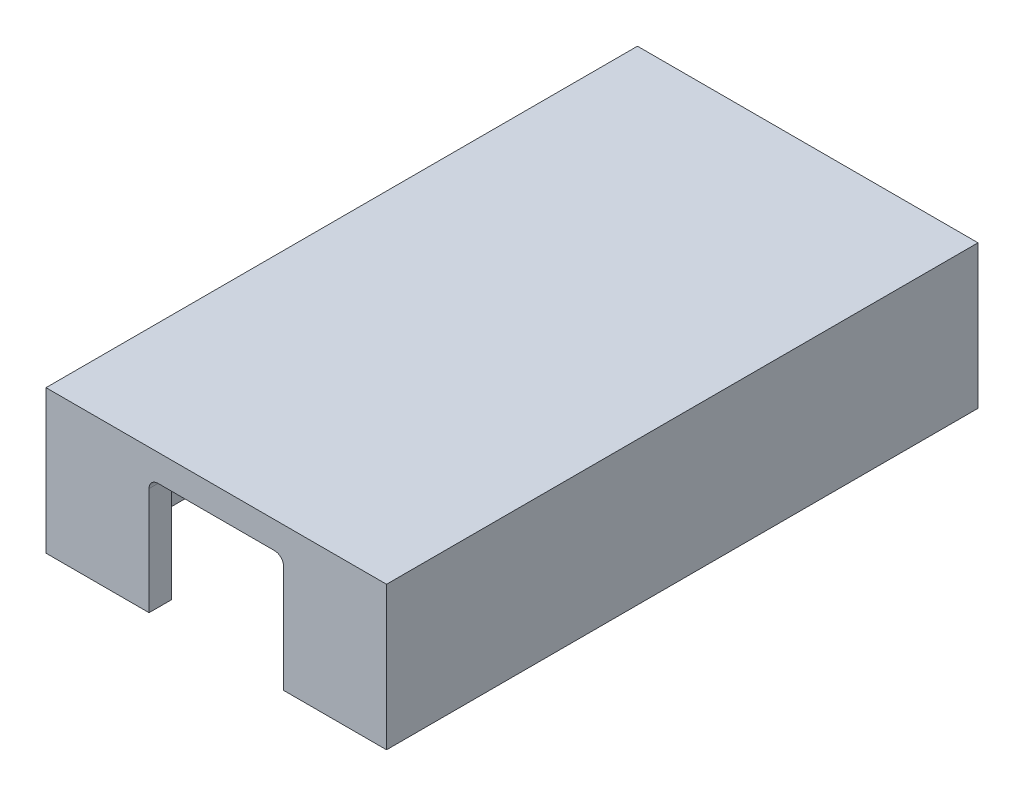
from build123d import *

# Parameters (mm, degrees)
SKETCH1_W           = 38
SKETCH1_H           = 66
BOSS_EXTRUDE1_DEPTH = 3
BOSS_EXTRUDE3_DEPTH = 13
SKETCH5_W           = 15
SKETCH5_H           = 1.5
BOSS_EXTRUDE4_DEPTH = 1.5
FILLET2_R           = 1
FILLET3_R           = 1


with BuildPart() as part:
    # Sketch1 → Boss-Extrude1 (new body)
    with BuildSketch(Plane(origin=(0, 0, 0), x_dir=(1, 0, 0), z_dir=(0, 1, 0))):
        Rectangle(SKETCH1_W, SKETCH1_H)
    extrude(amount=BOSS_EXTRUDE1_DEPTH)

    # Sketch2 → Boss-Extrude3 (add)
    with BuildSketch(Plane(origin=(0, 0, 0), x_dir=(1, 0, 0), z_dir=(0, 1, 0))):
        Polygon((2.5, 30.5), (2.5, 33), (19, 33), (19, -33), (7.5, -33), (7.5, -30.5), (16.5, -30.5), (16.5, 30.5), align=None)
        Polygon((-19, 33), (-19, -33), (-7.5, -33), (-7.5, -30.5), (-16.5, -30.5), (-16.5, 30.5), (-8.5, 30.5), (-8.5, 33), align=None)
    extrude(amount=-BOSS_EXTRUDE3_DEPTH)

    # Sketch5 → Boss-Extrude4 (add)
    with BuildSketch(Plane.ZY.offset(-16.5)):
        with Locations((0, -12.25)):
            Rectangle(SKETCH5_W, SKETCH5_H)
    boss_extrude4 = extrude(amount=BOSS_EXTRUDE4_DEPTH)

    # Mirror1: Boss-Extrude4 across plane
    add(boss_extrude4.mirror(Plane(origin=(0, 0, 0), x_dir=(0, 0, 1), z_dir=(1, 0, 0))))

    # Fillet2
    fillet2_edges = [part.edges().sort_by_distance(p)[0] for p in [
        (15, -13, 0),
        (-15, -13, 0),
    ]]
    fillet(fillet2_edges, radius=FILLET2_R)

    # Fillet3
    fillet3_edges = [part.edges().sort_by_distance(p)[0] for p in [
        (-8.5, 0, -31.75),
        (2.5, 0, -31.75),
        (-12.5, 0, -30.5),
        (9.5, 0, -30.5),
        (16.5, 0, 0),
        (7.5, 0, 31.75),
        (12, 0, 30.5),
        (-16.5, 0, 0),
        (-12, 0, 30.5),
        (-7.5, 0, 31.75),
    ]]
    fillet(fillet3_edges, radius=FILLET3_R)


solid = part.part
